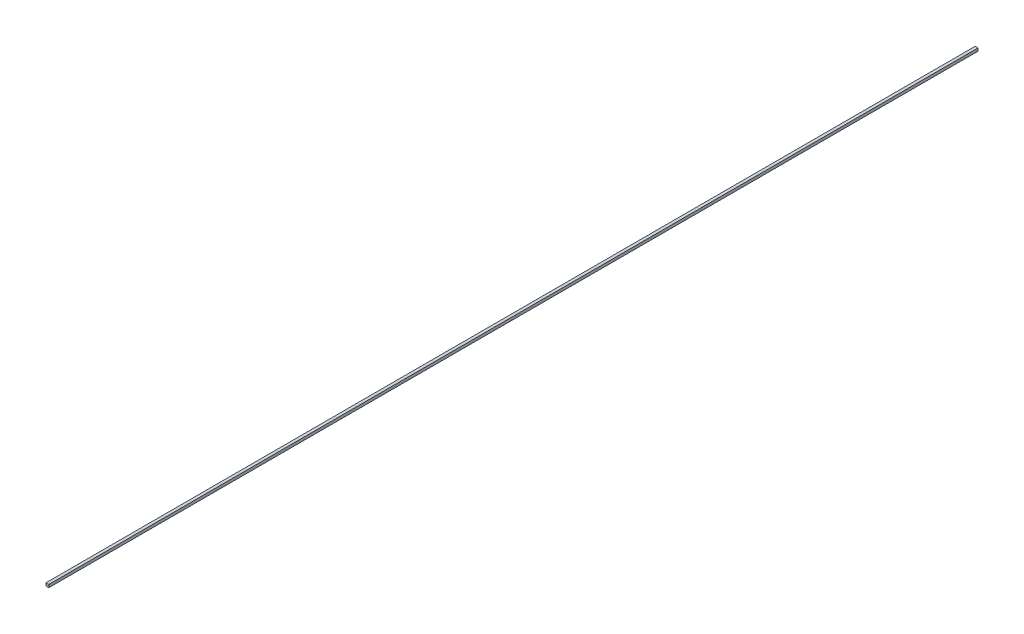
from build123d import *

# Parameters (mm, degrees)
SKETCH_1_W      = 2
SKETCH_1_H      = 2
EXTRUDE_1_DEPTH = 651.5


with BuildPart() as part:
    # 草图1 → 凸台-拉伸1 (new body)
    with BuildSketch(Plane.XY):
        with Locations((1, 1)):
            Rectangle(SKETCH_1_W, SKETCH_1_H)
    extrude(amount=EXTRUDE_1_DEPTH)


solid = part.part
